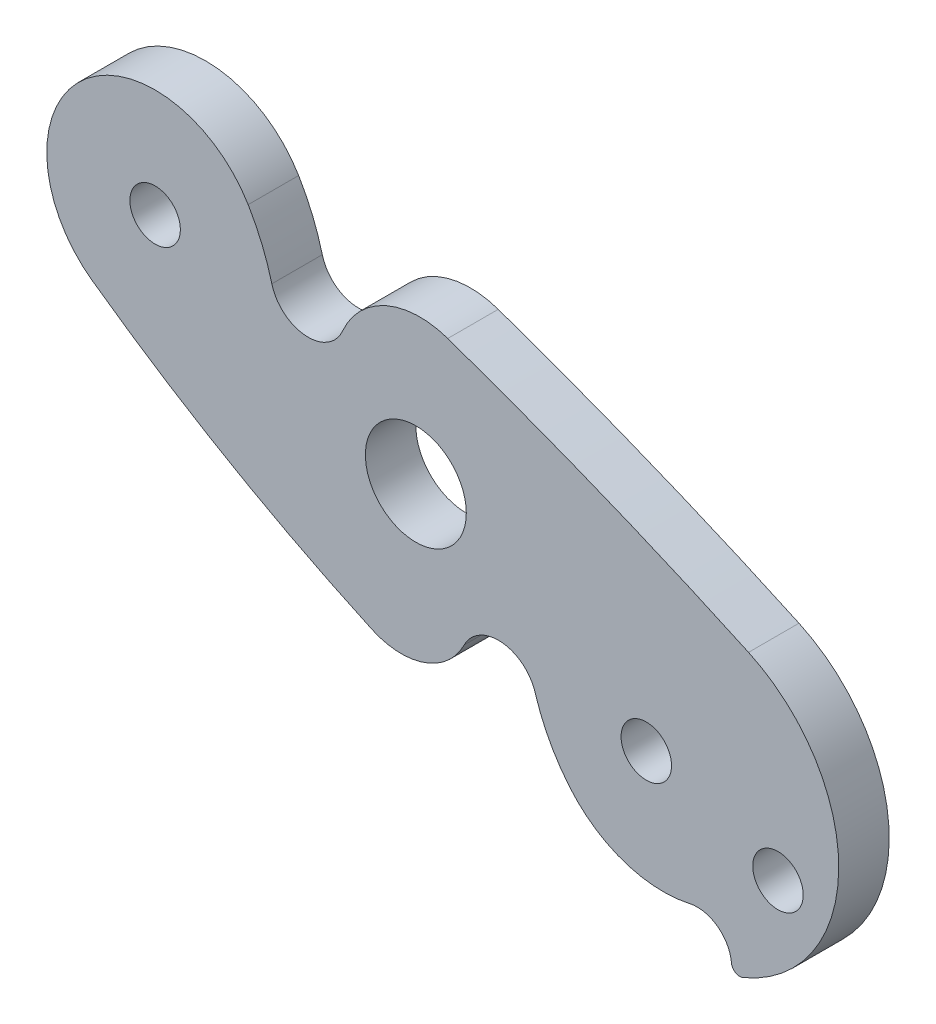
from build123d import *

# Parameters (mm, degrees)
ESQUISSE1_R        = 3
ESQUISSE1_R_2      = 1.5
BOSS_EXTRU_1_DEPTH = 3
CONG_1_R           = 0.5


with BuildPart() as part:
    # Esquisse1 → Boss.-Extru.1 (new body)
    with BuildSketch(Plane.XY):
        with BuildLine():
            ThreePointArc((-9.967950619, 9.398353751), (-19.856771897, 10.843547876), (-19.255850538, 0.867763905))
            ThreePointArc((-19.255850538, 0.867763905), (-11.16183771, -4.367412674), (-2.599104383, -8.794569261))
            ThreePointArc((-2.599104383, -8.794569261), (0.527471635, -8.932442445), (2.869569032, -6.856613359))
            ThreePointArc((2.869569032, -6.856613359), (5.106974254, -5.597078916), (7.101036237, -7.214523181))
            ThreePointArc((7.101036237, -7.214523181), (7.91789358, -9.198392931), (9.106885228, -10.984252378))
            ThreePointArc((9.106885228, -10.984252378), (12.345329643, -13.241699917), (16.286687996, -13.463704315))
            ThreePointArc((16.286687996, -13.463704315), (18.195594291, -14.034021941), (18.707504902, -15.959413581))
            ThreePointArc((18.707504902, -15.959413581), (25.123132348, -7.73541187), (19.778982477, 1.22196173))
            ThreePointArc((19.778982477, 1.22196173), (10.927169302, 5.05077079), (1.899061951, 8.443063964))
            ThreePointArc((1.899061951, 8.443063964), (-1.768338506, 8.299023868), (-4.357336538, 5.697550659))
            ThreePointArc((-4.357336538, 5.697550659), (-6.576456411, 4.361139029), (-8.561108443, 6.025964956))
            ThreePointArc((-8.561108443, 6.025964956), (-9.144248361, 7.762336434), (-9.967950619, 9.398353751))
        make_face()
        Circle(ESQUISSE1_R, mode=Mode.SUBTRACT)
        with Locations((-15.5, 6.1)):
            Circle(ESQUISSE1_R_2, mode=Mode.SUBTRACT)
        with Locations((13.7, -6.9)):
            Circle(ESQUISSE1_R_2, mode=Mode.SUBTRACT)
        with Locations((21.53, -9.653379741)):
            Circle(ESQUISSE1_R_2, mode=Mode.SUBTRACT)
    extrude(amount=BOSS_EXTRU_1_DEPTH)

    # Congé1
    cong_1_edges = [part.edges().sort_by_distance(p)[0] for p in [
        (18.707504902, -15.959413581, 1.5),
    ]]
    fillet(cong_1_edges, radius=CONG_1_R)


solid = part.part
